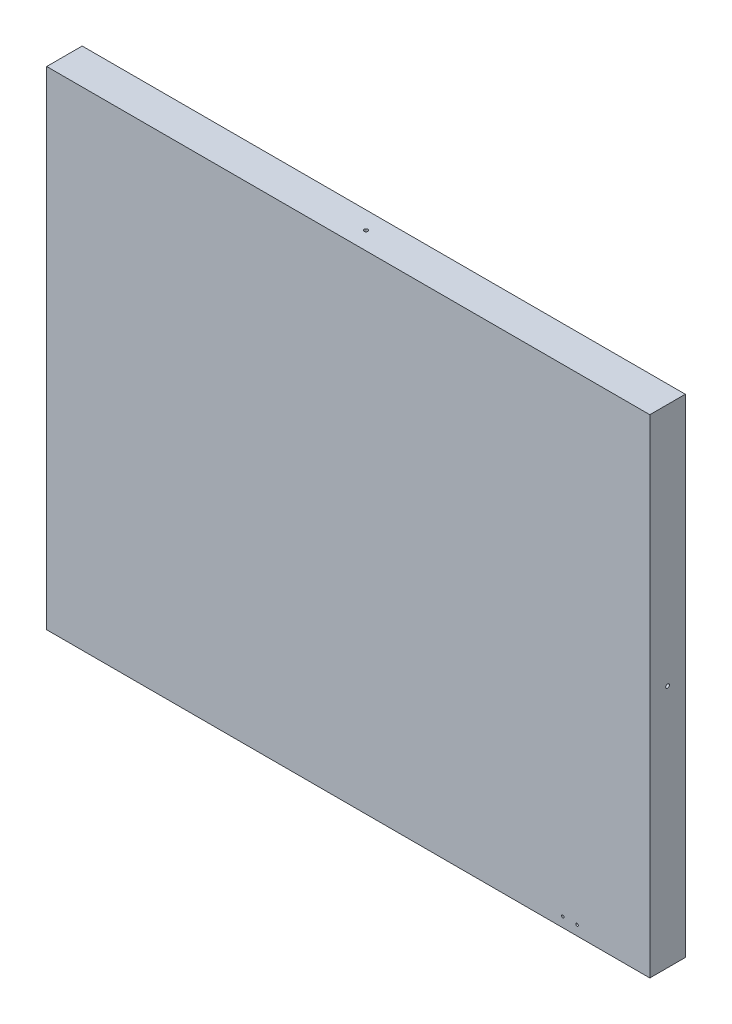
from build123d import *

# Parameters (mm, degrees)
SKETCH_1_W               = 680
SKETCH_1_H               = 550
EXTRUDE_1_DEPTH          = 40
HOLE_WIZARD_M5_1_D       = 4.2
HOLE_WIZARD_M5_2_D       = 4.2
HOLE_WIZARD_M3_5_1_D     = 2.9
HOLE_WIZARD_M3_5_1_DEPTH = 5
HOLE_WIZARD_M3_5_1_TIP   = 0.871247898


with BuildPart() as part:
    # 草图1 → 凸台-拉伸1 (new body)
    with BuildSketch(Plane.XY):
        Rectangle(SKETCH_1_W, SKETCH_1_H)
    extrude(amount=EXTRUDE_1_DEPTH)

    # M5 螺纹孔1 (through all)
    with Locations(Plane(origin=(0, -275, 0), x_dir=(-1, 0, 0), z_dir=(0, -1, 0))):
        with Locations((0, -20)):
            Hole(HOLE_WIZARD_M5_1_D / 2)

    # M5 螺纹孔2 (through all)
    with Locations(Plane.ZY.offset(340)):
        with Locations((20, 0)):
            Hole(HOLE_WIZARD_M5_2_D / 2)

    # M3.5 螺纹孔1
    with Locations(Plane.XY.offset(40)):
        with Locations((258, -264), (242, -264)):
            Hole(HOLE_WIZARD_M3_5_1_D / 2, depth=HOLE_WIZARD_M3_5_1_DEPTH)
            with Locations((0, 0, -(HOLE_WIZARD_M3_5_1_DEPTH + HOLE_WIZARD_M3_5_1_TIP / 2))):  # 118° drill point
                Cone(0, HOLE_WIZARD_M3_5_1_D / 2, HOLE_WIZARD_M3_5_1_TIP, mode=Mode.SUBTRACT)


solid = part.part
